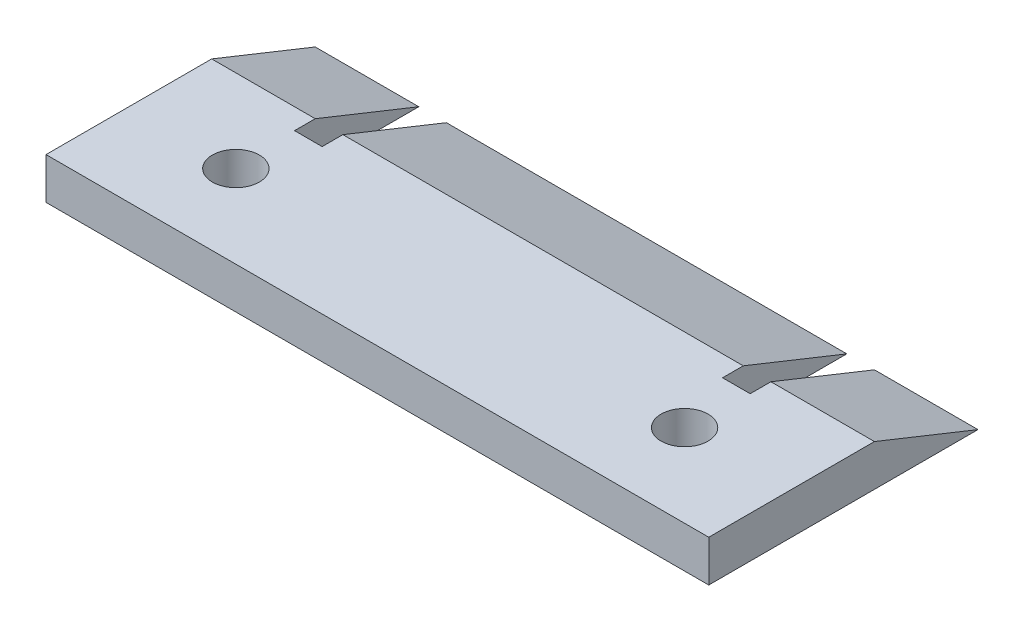
from build123d import *

# Parameters (mm, degrees)
EXTRUDE_1_DEPTH     = 48
HOLE_WIZARD_M8_1_D  = 6.8
SKETCH_4_W          = 4
SKETCH_4_H          = 18
CUT_EXTRUDE_1_DEPTH = 63.136945532


with BuildPart() as part:
    # 草图1 → 凸台-拉伸1 (new, symmetric)
    with BuildSketch(Plane(origin=(0, 0, 0), x_dir=(0, 0, -1), z_dir=(1, 0, 0))):
        Polygon((0, 0), (39, 0), (24, 6), (0, 6), align=None)
    extrude(amount=EXTRUDE_1_DEPTH, both=True)

    # M8 螺纹孔1 (through all)
    with Locations(Plane(origin=(0, 6, 0), x_dir=(1, 0, 0), z_dir=(0, 1, 0))):
        with Locations((32.5, 12), (-32.5, 12)):
            Hole(HOLE_WIZARD_M8_1_D / 2)

    # 草图4 → 切除-拉伸-薄壁1 (cut, symmetric)
    with BuildSketch(Plane(origin=(0, 6, 0), x_dir=(1, 0, 0), z_dir=(0, 1, 0))):
        with Locations((-31, 30)):
            Rectangle(SKETCH_4_W, SKETCH_4_H)
    cut_extrude_1 = extrude(amount=CUT_EXTRUDE_1_DEPTH, both=True, mode=Mode.SUBTRACT)

    # 镜向1: 切除-拉伸-薄壁1 across plane
    add(cut_extrude_1.mirror(Plane(origin=(0, 0, 0), x_dir=(0, 0, 1), z_dir=(1, 0, 0))), mode=Mode.SUBTRACT)


solid = part.part
